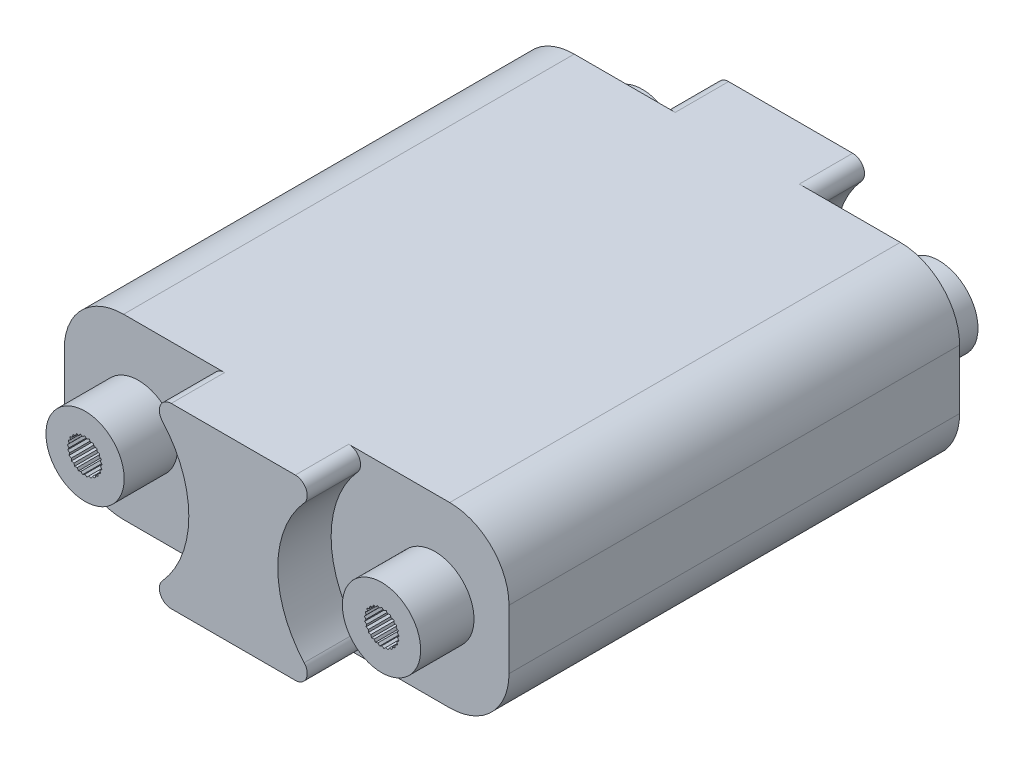
from build123d import *

# Parameters (mm, degrees)
SKETCH1_W           = 75
SKETCH1_H           = 94
BOSS_EXTRUDE1_DEPTH = 30
SKETCH2_W           = 20.025762067
SKETCH2_H           = 30
CUT_EXTRUDE5_DEPTH  = 9
SKETCH7_W           = 20.025762067
SKETCH7_H           = 30
CUT_EXTRUDE6_DEPTH  = 9
SKETCH8_R           = 6.6
BOSS_EXTRUDE2_DEPTH = 9
BOSS_EXTRUDE3_START = 9
SKETCH9_R           = 6.6
BOSS_EXTRUDE3_DEPTH = 9
FILLET1_R           = 10
CUT_EXTRUDE7_DEPTH  = 9
CUT_EXTRUDE8_START  = -9
CUT_EXTRUDE8_DEPTH  = 9
FILLET2_R           = 2
CUT_EXTRUDE10_DEPTH = 4
SKETCH14_W          = 37.5
SKETCH14_H          = 30
CUT_EXTRUDE11_DEPTH = 94


with BuildPart() as part:
    # Sketch1 → Boss-Extrude1 (new body)
    with BuildSketch(Plane(origin=(0, 0, 0), x_dir=(1, 0, 0), z_dir=(0, 1, 0))):
        Rectangle(SKETCH1_W, SKETCH1_H)
    extrude(amount=BOSS_EXTRUDE1_DEPTH)

    # Sketch2 → Cut-Extrude5 (cut)
    with BuildSketch(Plane.XY.offset(47)):
        with Locations((-27.487118966, 15)):
            Rectangle(SKETCH2_W, SKETCH2_H)
    extrude(amount=-CUT_EXTRUDE5_DEPTH, mode=Mode.SUBTRACT)

    # Sketch7 → Cut-Extrude6 (cut)
    with BuildSketch(Plane(origin=(0, 0, -47), x_dir=(-1, 0, 0), z_dir=(0, 0, -1))):
        with Locations((27.487118966, 15)):
            Rectangle(SKETCH7_W, SKETCH7_H)
    extrude(amount=-CUT_EXTRUDE6_DEPTH, mode=Mode.SUBTRACT)

    # Sketch8 → Boss-Extrude2 (add)
    with BuildSketch(Plane.XY.offset(38)):
        with Locations((-25, 15)):
            Circle(SKETCH8_R)
    extrude(amount=BOSS_EXTRUDE2_DEPTH)

    # Sketch9 → Boss-Extrude3 (add)
    with BuildSketch(Plane(origin=(0, 0, -38), x_dir=(-1, 0, 0), z_dir=(0, 0, -1)).offset(BOSS_EXTRUDE3_START)):
        with Locations(Location((25, 15, 0), (0, 0, 180))):
            Circle(SKETCH9_R)
    extrude(amount=-BOSS_EXTRUDE3_DEPTH)

    # Fillet1
    fillet1_edges = [part.edges().sort_by_distance(p)[0] for p in [
        (-37.5, 0, 0),
        (-37.5, 30, 0),
    ]]
    fillet(fillet1_edges, radius=FILLET1_R)

    # Sketch10 → Cut-Extrude7 (cut)
    with BuildSketch(Plane.XY.offset(47)):
        with BuildLine():
            Line((-15.986121811, 30), (-17.474237933, 30))
            Line((-17.474237933, 30), (-17.474237933, 0))
            Line((-17.474237933, 0), (-15.986121811, 0))
            ThreePointArc((-15.986121811, 0), (-7.5, 15), (-15.986121811, 30))
        make_face()
    extrude(amount=-CUT_EXTRUDE7_DEPTH, mode=Mode.SUBTRACT)

    # Sketch11 → Cut-Extrude8 (cut)
    with BuildSketch(Plane(origin=(0, 0, -47), x_dir=(-1, 0, 0), z_dir=(0, 0, -1)).offset(CUT_EXTRUDE8_START)):
        with BuildLine():
            Line((15.986121811, 30), (17.474237933, 30))
            Line((17.474237933, 30), (17.474237933, 0))
            Line((17.474237933, 0), (15.986121811, 0))
            ThreePointArc((15.986121811, 0), (7.5, 15), (15.986121811, 30))
        make_face()
    extrude(amount=CUT_EXTRUDE8_DEPTH, mode=Mode.SUBTRACT)

    # Fillet2
    fillet2_edges = [part.edges().sort_by_distance(p)[0] for p in [
        (-15.986121811, 30, 42.5),
        (-15.986121811, 0, 42.5),
        (-15.986121811, 0, -42.5),
        (-15.986121811, 30, -42.5),
    ]]
    fillet(fillet2_edges, radius=FILLET2_R)

    # Sketch13 → Cut-Extrude10 (cut)
    with BuildSketch(Plane.XY.offset(47)):
        Polygon((-26.622500709, 17.20554754), (-26.458244341, 17.605297016), (-26.032711731, 17.529786775), (-25.774202126, 17.876128488), (-25.380817039, 17.697164883), (-25.044297307, 17.96833691), (-24.707777575, 17.697164883), (-24.314392488, 17.876128488), (-24.055882883, 17.529786775), (-23.630350274, 17.605297016), (-23.466093905, 17.20554754), (-23.035151551, 17.172859831), (-22.97546925, 16.744820322), (-22.566194846, 16.605988553), (-22.614836671, 16.176554308), (-22.252946432, 15.940301788), (-22.406856039, 15.53645574), (-22.115088859, 15.217627085), (-22.364595541, 14.864744365), (-22.161284226, 14.483372752), (-22.490710561, 14.20362628), (-22.388629908, 13.783674689), (-22.777276827, 13.594641965), (-22.782840939, 13.1624975), (-23.206288328, 13.076056145), (-23.319147592, 12.658872031), (-23.750788692, 12.680453474), (-23.963851745, 12.304442924), (-24.37656496, 12.432691122), (-24.676444267, 12.121480262), (-25.044297307, 12.34833691), (-25.412150348, 12.121480262), (-25.712029654, 12.432691122), (-26.124742869, 12.304442924), (-26.337805922, 12.680453474), (-26.769447023, 12.658872031), (-26.882306286, 13.076056145), (-27.305753675, 13.1624975), (-27.311317787, 13.594641965), (-27.699964706, 13.783674689), (-27.597884053, 14.20362628), (-27.927310388, 14.483372752), (-27.723999073, 14.864744365), (-27.973505755, 15.217627085), (-27.681738575, 15.53645574), (-27.835648182, 15.940301788), (-27.473757943, 16.176554308), (-27.522399768, 16.605988553), (-27.113125364, 16.744820322), (-27.053443063, 17.172859831), align=None)
    extrude(amount=-CUT_EXTRUDE10_DEPTH, mode=Mode.SUBTRACT)

    # Sketch14 → Cut-Extrude11 (cut)
    with BuildSketch(Plane.XY.offset(47)):
        with Locations((18.75, 15)):
            Rectangle(SKETCH14_W, SKETCH14_H)
    extrude(amount=-CUT_EXTRUDE11_DEPTH, mode=Mode.SUBTRACT)

    # Mirror2: part across plane


with BuildPart() as part_1:
    add(part.part)
    add(part.part.mirror(Plane(origin=(0, 0, -47), x_dir=(0, 0, 1), z_dir=(-1, 0, 0))))


solid = part_1.part
